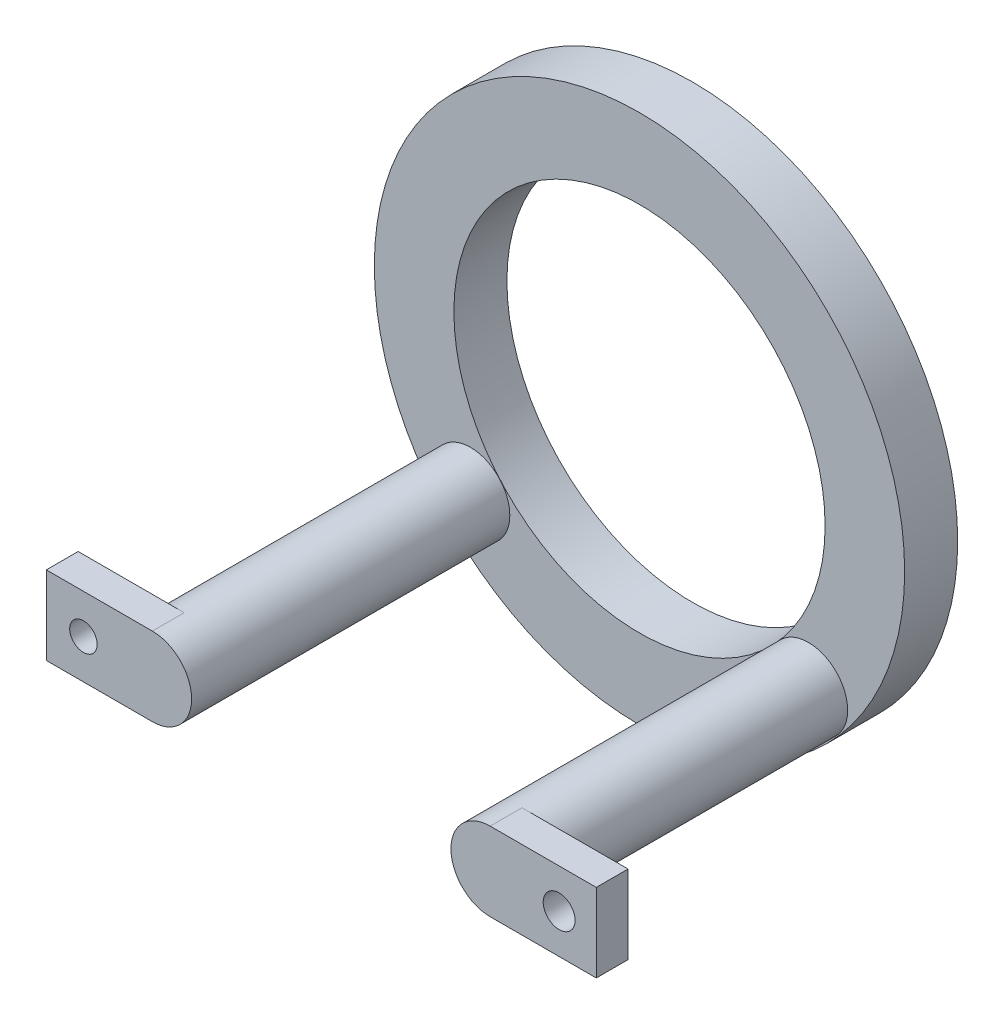
from build123d import *

# Parameters (mm, degrees)
ESQUISSE1_R        = 50
ESQUISSE1_R_2      = 35
BOSS_EXTRU_2_DEPTH = 10
ESQUISSE4_R        = 7.4
BOSS_EXTRU_3_DEPTH = 70
ESQUISSE5_W        = 20
ESQUISSE5_H        = 14.8
ESQUISSE5_R        = 2.588125741
ESQUISSE5_R_2      = 3.00370922
BOSS_EXTRU_4_DEPTH = 6


with BuildPart() as part:
    # Esquisse1 → Boss.-Extru.2 (new body)
    with BuildSketch(Plane.XY):
        Circle(ESQUISSE1_R)
        Circle(ESQUISSE1_R_2, mode=Mode.SUBTRACT)
    extrude(amount=BOSS_EXTRU_2_DEPTH)

    # Esquisse4 → Boss.-Extru.3 (add)
    with BuildSketch(Plane.XY):
        with Locations((-31.85, -28)):
            Circle(ESQUISSE4_R)
        with Locations((31.85, -28)):
            Circle(ESQUISSE4_R)
    extrude(amount=BOSS_EXTRU_3_DEPTH)

    # Esquisse5 → Boss.-Extru.4 (add)
    # profile 1 of 2: a face of its own
    with BuildSketch(Plane.XY.offset(70)):
        with Locations((-41.85, -28)):
            Rectangle(ESQUISSE5_W, ESQUISSE5_H)
        with Locations((-44.85, -28)):
            Circle(ESQUISSE5_R, mode=Mode.SUBTRACT)
    # profile 2 of 2: a face of its own
    with BuildSketch(Plane.XY.offset(70)):
        with Locations((41.85, -28)):
            Rectangle(ESQUISSE5_W, ESQUISSE5_H)
        with Locations((44.85, -28)):
            Circle(ESQUISSE5_R_2, mode=Mode.SUBTRACT)
    extrude(amount=-BOSS_EXTRU_4_DEPTH)


solid = part.part
